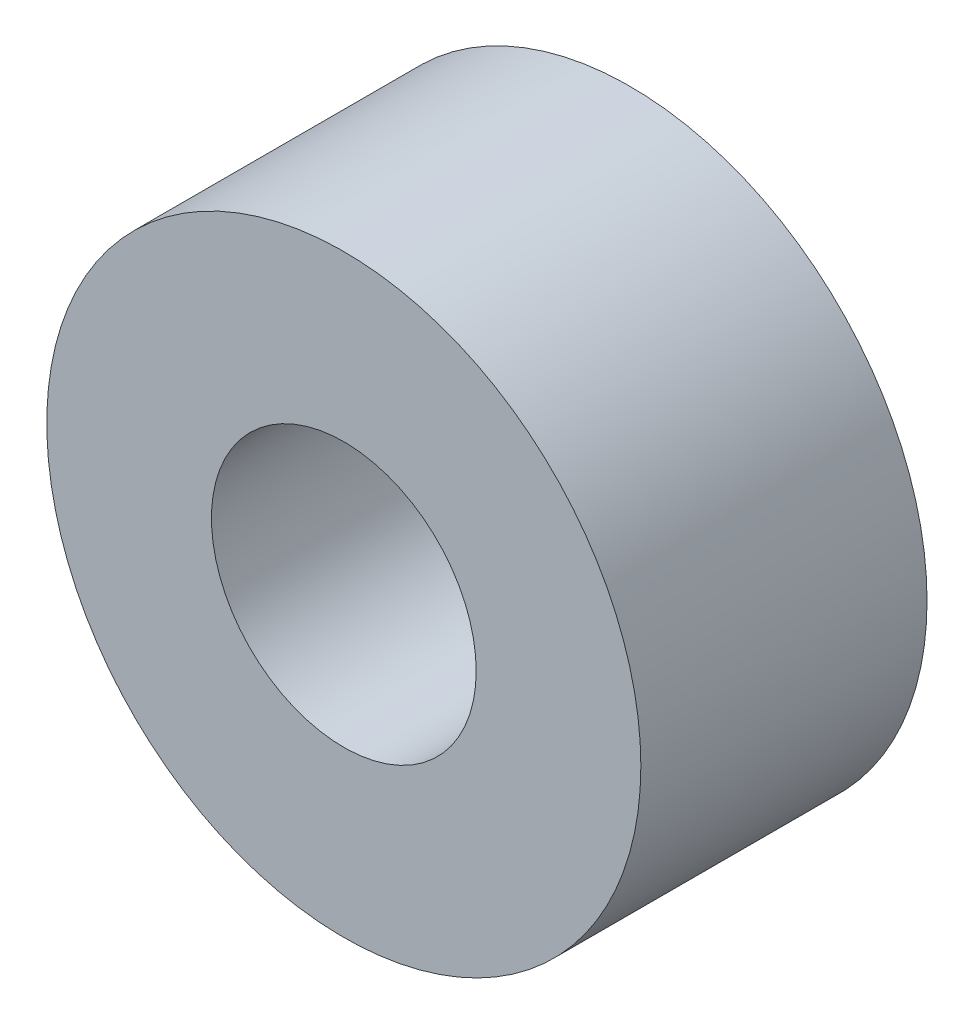
from build123d import *

# Parameters (mm, degrees)
SKETCH1_R           = 12.5095
SKETCH1_R_2         = 5.5753
BOSS_EXTRUDE1_DEPTH = 6.02615


with BuildPart() as part:
    # Sketch1 → Boss-Extrude1 (new, symmetric)
    with BuildSketch(Plane.XY):
        Circle(SKETCH1_R)
        Circle(SKETCH1_R_2, mode=Mode.SUBTRACT)
    extrude(amount=BOSS_EXTRUDE1_DEPTH, both=True)


solid = part.part
